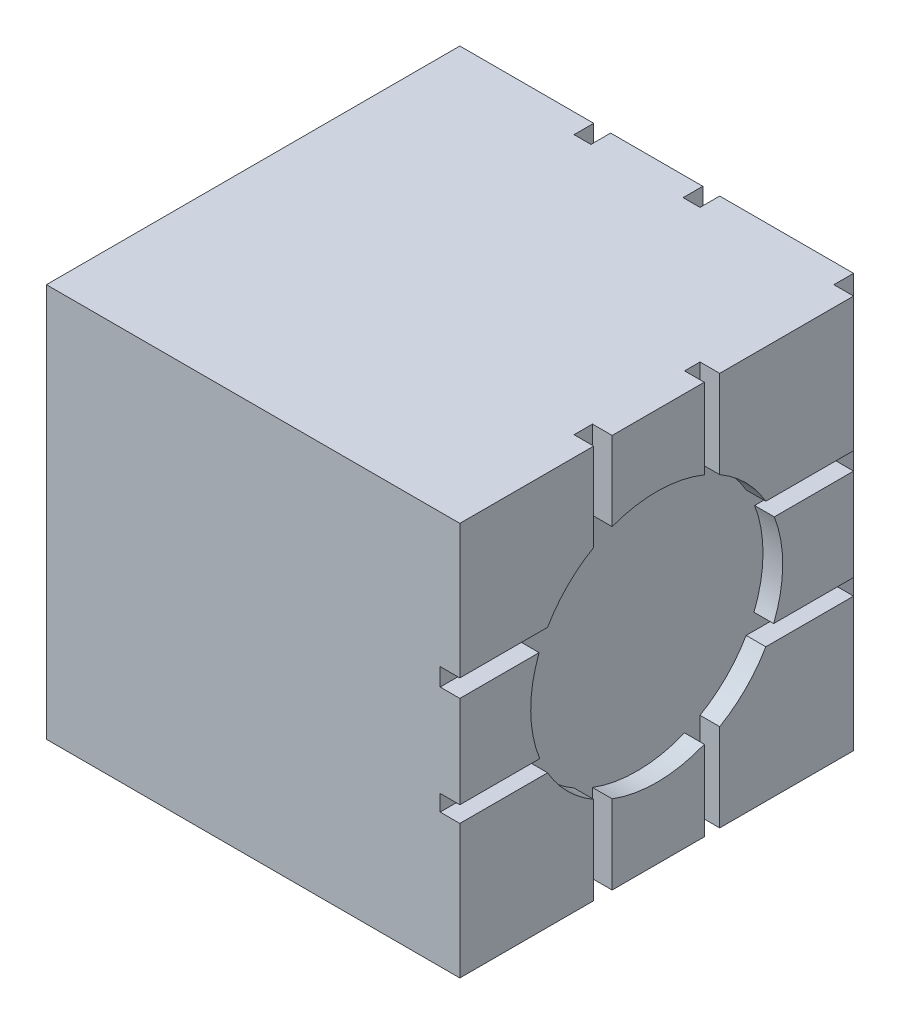
from build123d import *

# Parameters (mm, degrees)
SKETCH1_W           = 127
SKETCH1_H           = 127
BOSS_EXTRUDE1_DEPTH = 127
SKETCH13_W          = 43.18
SKETCH13_H          = 43.18
SKETCH13_W_2        = 29.718
SKETCH13_H_2        = 29.718
BOSS_EXTRUDE7_DEPTH = 6.35
SKETCH29_R          = 40.64
CUT_EXTRUDE10_DEPTH = 6.35
SKETCH27_W          = 43.18
SKETCH27_H          = 43.18
SKETCH27_W_2        = 29.718
SKETCH27_H_2        = 29.718
BOSS_EXTRUDE8_DEPTH = 6.35
SKETCH28_R          = 40.64
CUT_EXTRUDE11_DEPTH = 6.35


with BuildPart() as part:
    # Sketch1 → Boss-Extrude1 (new body)
    with BuildSketch(Plane.XY):
        Rectangle(SKETCH1_W, SKETCH1_H)
    extrude(amount=BOSS_EXTRUDE1_DEPTH)

    # Sketch13 → Boss-Extrude7 (add)
    with BuildSketch(Plane(origin=(0, 0, 0), x_dir=(-1, 0, 0), z_dir=(0, 0, -1))):
        with Locations((-41.91, 41.91)):
            Rectangle(SKETCH13_W, SKETCH13_H)
        with Locations((-41.91, -41.91)):
            Rectangle(SKETCH13_W, SKETCH13_H)
        with Locations((41.91, 41.91)):
            Rectangle(SKETCH13_W, SKETCH13_H)
        with Locations((41.91, -41.91)):
            Rectangle(SKETCH13_W, SKETCH13_H)
        with Locations((-48.641, 0)):
            Rectangle(SKETCH13_W_2, SKETCH13_H_2)
        with Locations((0, -48.641)):
            Rectangle(SKETCH13_W_2, SKETCH13_H_2)
        with Locations((48.641, 0)):
            Rectangle(SKETCH13_W_2, SKETCH13_H_2)
        with Locations((0, 48.641)):
            Rectangle(SKETCH13_W_2, SKETCH13_H_2)
    extrude(amount=BOSS_EXTRUDE7_DEPTH)

    # Sketch29 → Cut-Extrude10 (cut)
    with BuildSketch(Plane(origin=(0, 0, 0), x_dir=(-1, 0, 0), z_dir=(0, 0, -1))):
        Circle(SKETCH29_R)
    extrude(amount=CUT_EXTRUDE10_DEPTH, mode=Mode.SUBTRACT)

    # Sketch27 → Boss-Extrude8 (add)
    with BuildSketch(Plane(origin=(63.5, 0, 0), x_dir=(0, 0, -1), z_dir=(1, 0, 0))):
        with Locations((-105.41, 41.91)):
            Rectangle(SKETCH27_W, SKETCH27_H)
        with Locations((-105.41, -41.91)):
            Rectangle(SKETCH27_W, SKETCH27_H)
        with Locations((-21.59, 41.91)):
            Rectangle(SKETCH27_W, SKETCH27_H)
        with Locations((-21.59, -41.91)):
            Rectangle(SKETCH27_W, SKETCH27_H)
        with Locations((-112.141, -0.254760407)):
            Rectangle(SKETCH27_W_2, SKETCH27_H_2)
        with Locations((-63.013602448, -48.641)):
            Rectangle(SKETCH27_W_2, SKETCH27_H_2)
        with Locations((-14.859, -0.254760407)):
            Rectangle(SKETCH27_W_2, SKETCH27_H_2)
        with Locations((-63.013602448, 48.641)):
            Rectangle(SKETCH27_W_2, SKETCH27_H_2)
    extrude(amount=BOSS_EXTRUDE8_DEPTH)

    # Sketch28 → Cut-Extrude11 (cut)
    with BuildSketch(Plane(origin=(63.5, 0, 0), x_dir=(0, 0, -1), z_dir=(1, 0, 0))):
        with Locations((-63.5, 0)):
            Circle(SKETCH28_R)
    extrude(amount=CUT_EXTRUDE11_DEPTH, mode=Mode.SUBTRACT)


solid = part.part
